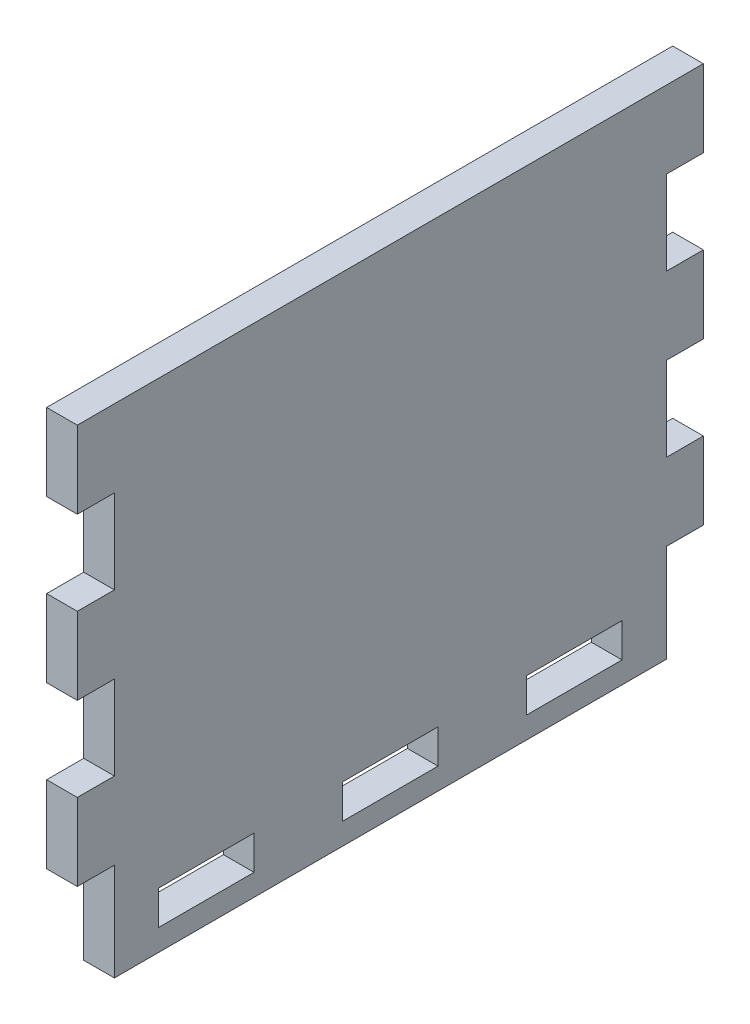
from build123d import *

# Parameters (mm, degrees)
SKETCH2_W           = 13.987360838
SKETCH2_H           = 4.9958
SKETCH2_W_2         = 13.987360839
BOSS_EXTRUDE1_DEPTH = 4.4958


with BuildPart() as part:
    # Sketch2 → Boss-Extrude1 (new body)
    with BuildSketch(Plane.ZY.offset(44.7458)):
        Polygon((5.4356, 40.058729674), (0, 40.058729674), (0, 28.740547856), (5.4356, 28.740547856), (5.4356, 16.422366038), (0, 16.422366038), (0, 5.104184219), (5.4356, 5.104184219), (5.4356, -7.213997599), (0, -7.213997599), (0, -18.532179417), (5.4356, -18.532179417), (5.4356, -32.862070326), (86.359765029, -32.862070326), (86.359765029, -18.532179417), (91.795365029, -18.532179417), (91.795365029, -7.213997599), (86.359765029, -7.213997599), (86.359765029, 5.104184219), (91.795365029, 5.104184219), (91.795365029, 16.422366038), (86.359765029, 16.422366038), (86.359765029, 28.740547856), (91.795365029, 28.740547856), (91.795365029, 40.058729674), (86.359765029, 40.058729674), align=None)
        with Locations((18.922960838, -27.189170326)):
            Rectangle(SKETCH2_W, SKETCH2_H, mode=Mode.SUBTRACT)
        with Locations((45.897682515, -27.189170326)):
            Rectangle(SKETCH2_W_2, SKETCH2_H, mode=Mode.SUBTRACT)
        with Locations((72.872404191, -27.189170326)):
            Rectangle(SKETCH2_W, SKETCH2_H, mode=Mode.SUBTRACT)
    extrude(amount=-BOSS_EXTRUDE1_DEPTH)


solid = part.part
